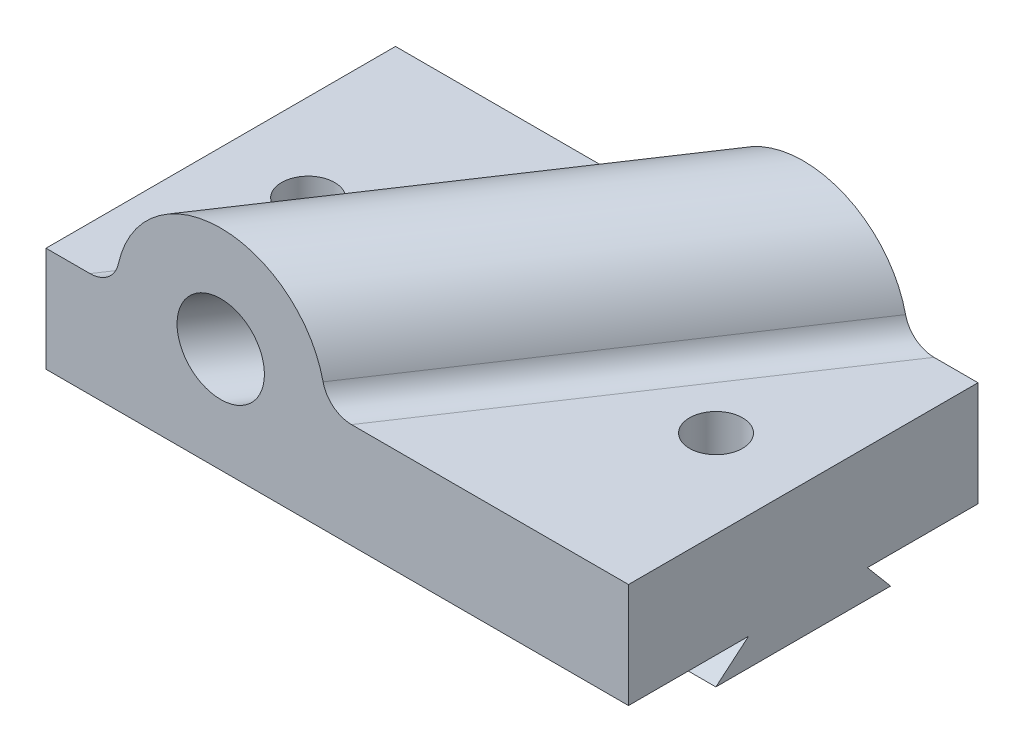
from build123d import *

# Parameters (mm, degrees)
SKETCH1_W               = 60
SKETCH1_H               = 18
BOSS_EXTRUDE1_DEPTH     = 100
SKETCH6_R               = 7.5
CUT_EXTRUDE1_DEPTH      = 123.049170419
CUT_EXTRUDE1_DEPTH_BACK = 123.049170419
SKETCH7_R               = 4.551669689


with BuildPart() as part:
    # Sketch1 → Boss-Extrude1 (new body)
    with BuildSketch(Plane(origin=(0, 0, 0), x_dir=(0, 0, -1), z_dir=(1, 0, 0))):
        with Locations((30, 9)):
            Rectangle(SKETCH1_W, SKETCH1_H)
        Polygon((41.010615422, 0), (20.608108108, 0), (15, -4.73), (45, -4.73), align=None)
    extrude(amount=BOSS_EXTRUDE1_DEPTH)

    # Sweep5: sweep along a path in Sketch3
    with BuildLine(Plane(origin=(0, 0, 0), x_dir=(1, 0, 0), z_dir=(0, 1, 0))) as sweep5_path:
        Line((30, 0), (70, 60))
    # Sketch2 → Sweep5 (sweep)
    with BuildSketch(Plane.XY):
        with BuildLine():
            Line((7.550055679, 18), (52.449944321, 18))
            ThreePointArc((52.449944321, 18), (49.32222811, 19.099052512), (47.569521642, 21.913043478))
            ThreePointArc((47.569521642, 21.913043478), (30, 36), (12.430478358, 21.913043478))
            ThreePointArc((12.430478358, 21.913043478), (10.67777189, 19.099052512), (7.550055679, 18))
        make_face()
    sweep(path=sweep5_path.line)

    # Cut-Sweep3: sweep along a path in Sketch3<4>
    with BuildLine(Plane(origin=(0, 0, 0), x_dir=(1, 0, 0), z_dir=(0, 1, 0))) as cut_sweep3_path:
        Line((30, 0), (70, 60))
    # Sketch6 → Cut-Sweep3 (sweep, cut)
    with BuildSketch(Plane(origin=(0, 0, -60), x_dir=(-1, 0, 0), z_dir=(0, 0, -1))):
        with Locations((-69.99646769, 18)):
            Circle(SKETCH6_R)
    sweep(path=cut_sweep3_path.line, mode=Mode.SUBTRACT)

    # Sketch7 → Cut-Extrude1 (cut, two sides: drawn at the far end of the back side and taken through both)
    with BuildSketch(Plane(origin=(0, 0, 0), x_dir=(1, 0, 0), z_dir=(0, 1, 0)).offset(-CUT_EXTRUDE1_DEPTH_BACK)):
        with Locations(Location((15, 30, 0), (0, 0, 270))):
            Circle(SKETCH7_R)
        with Locations(Location((84.999992632, 30.022710288, 0), (0, 0, 270))):
            Circle(SKETCH7_R)
    extrude(amount=CUT_EXTRUDE1_DEPTH + CUT_EXTRUDE1_DEPTH_BACK, mode=Mode.SUBTRACT)


solid = part.part
